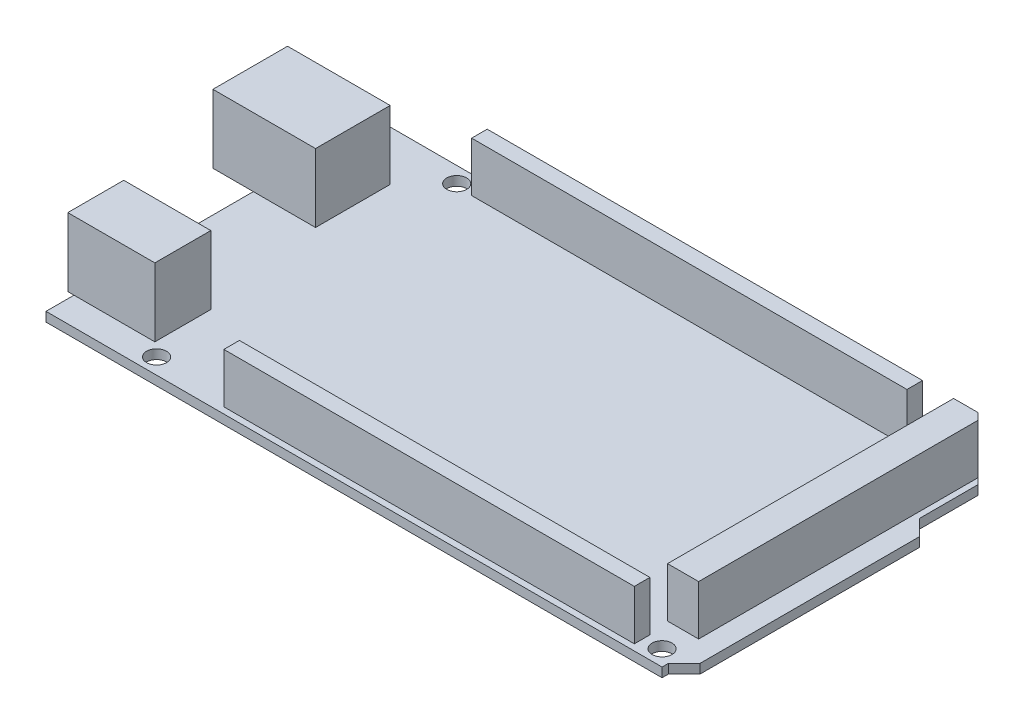
from build123d import *

# Parameters (mm, degrees)
SKETCH_1_R      = 1.6
EXTRUDE_1_DEPTH = 1.5
SKETCH_1_3_W    = 70
SKETCH_1_3_H    = 2.5
SKETCH_1_3_W_2  = 66
EXTRUDE_2_DEPTH = 8
SKETCH_1_4_W    = 16.5
SKETCH_1_4_H    = 12
EXTRUDE_3_DEPTH = 11
SKETCH_1_5_W    = 14
SKETCH_1_5_H    = 9
EXTRUDE_4_DEPTH = 11


with BuildPart() as part:
    # Эскиз1 → Бобышка-Вытянуть1 (new body)
    with BuildSketch(Plane(origin=(0, 0, 0), x_dir=(1, 0, 0), z_dir=(0, 1, 0))):
        Polygon((-22.889699569, -15.497660222), (76.170300431, -15.497660222), (76.170300431, -14.497660222), (78.710300431, -11.957660222), (78.710300431, 23.362339778), (76.170300431, 25.902339778), (76.170300431, 35.302339778), (73.630300431, 37.842339778), (-22.889699569, 37.842339778), align=None)
        with Locations((-7.649699569, -12.957660222)):
            Circle(SKETCH_1_R, mode=Mode.SUBTRACT)
        with Locations((73.630300431, -12.957660222)):
            Circle(SKETCH_1_R, mode=Mode.SUBTRACT)
        with Locations((-7.649699569, 35.302339778)):
            Circle(SKETCH_1_R, mode=Mode.SUBTRACT)
        with Locations((67.280300431, 35.302339778)):
            Circle(SKETCH_1_R, mode=Mode.SUBTRACT)
    extrude(amount=-EXTRUDE_1_DEPTH)

    # Эскиз1<3> → Бобышка-Вытянуть2 (add)
    with BuildSketch(Plane(origin=(0, 0, 0), x_dir=(1, 0, 0), z_dir=(0, 1, 0))):
        Polygon((75.210300431, 36.262339778), (74.130300431, 37.342339778), (70.210300431, 37.342339778), (70.210300431, -8.657660222), (75.210300431, -8.657660222), align=None)
        with Locations((30.210300431, 36.092339778)):
            Rectangle(SKETCH_1_3_W, SKETCH_1_3_H)
        with Locations((37.710300431, -13.247660222)):
            Rectangle(SKETCH_1_3_W_2, SKETCH_1_3_H)
    extrude(amount=EXTRUDE_2_DEPTH)

    # Эскиз1<4> → Бобышка-Вытянуть3 (add)
    with BuildSketch(Plane(origin=(0, 0, 0), x_dir=(1, 0, 0), z_dir=(0, 1, 0))):
        with Locations((-21.139699569, 23.842339778)):
            Rectangle(SKETCH_1_4_W, SKETCH_1_4_H)
    extrude(amount=EXTRUDE_3_DEPTH)

    # Эскиз1<5> → Бобышка-Вытянуть4 (add)
    with BuildSketch(Plane(origin=(0, 0, 0), x_dir=(1, 0, 0), z_dir=(0, 1, 0))):
        with Locations((-16.889699569, -6.497660222)):
            Rectangle(SKETCH_1_5_W, SKETCH_1_5_H)
    extrude(amount=EXTRUDE_4_DEPTH)


solid = part.part
